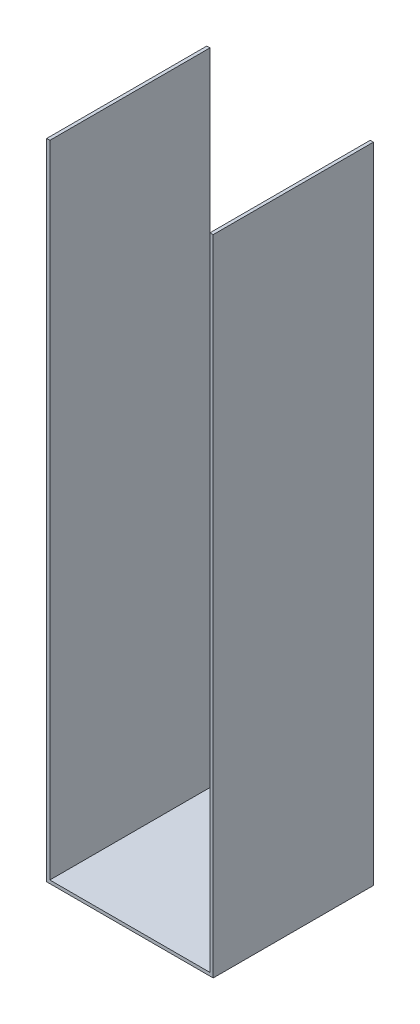
from build123d import *

# Parameters (mm, degrees)
BOSS_EXTRUDE1_DEPTH = 10000


with BuildPart() as part:
    # Sketch1 → Boss-Extrude1 (new body)
    with BuildSketch(Plane.XY):
        Polygon((0, 0), (0, -40000), (10000, -40000), (10000, 0), (10200, 0), (10200, -40200), (-200, -40200), (-200, 0), align=None)
    extrude(amount=BOSS_EXTRUDE1_DEPTH)


solid = part.part
